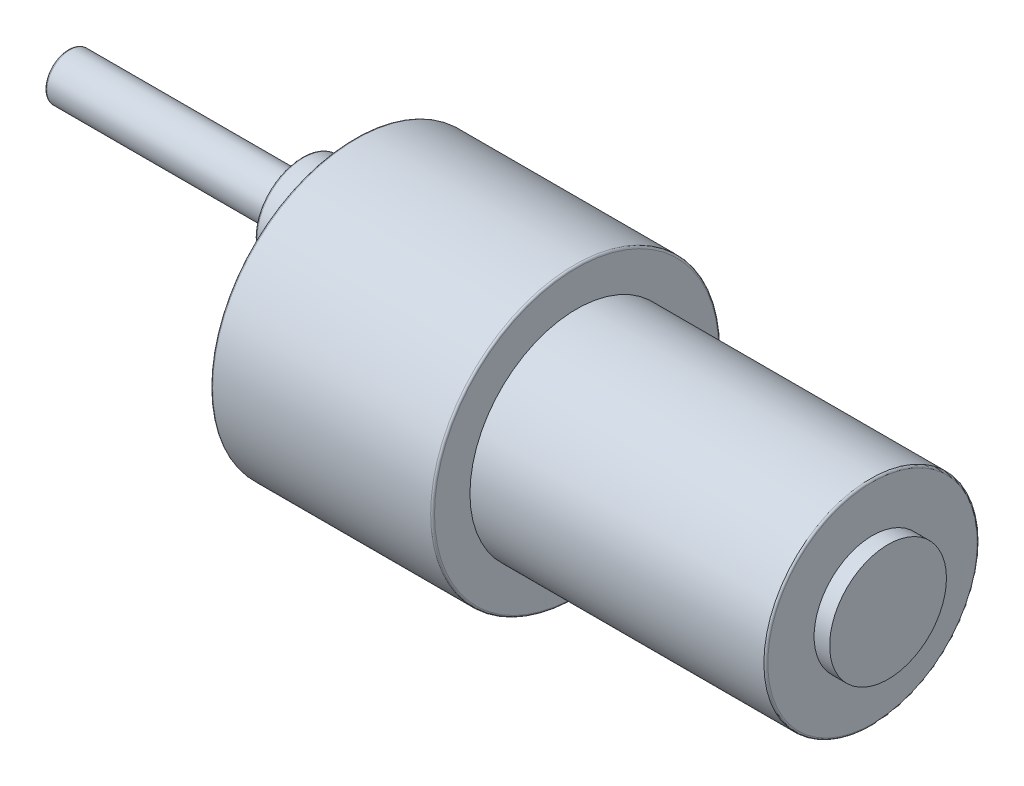
from build123d import *

# Parameters (mm, degrees)
SKETCH1_R                       = 18.5
BOSS_EXTRUDE1_DEPTH             = 28.5
SKETCH2_R                       = 13.7
BOSS_EXTRUDE2_DEPTH             = 38
SKETCH3_R                       = 7.5
BOSS_EXTRUDE3_DEPTH             = 2
TAP_DRILL_FOR_M3X0_5_TAP1_D     = 2.5
TAP_DRILL_FOR_M3X0_5_TAP1_DEPTH = 5
TAP_DRILL_FOR_M3X0_5_TAP1_TIP   = 0.751075774
SKETCH6_R                       = 6
BOSS_EXTRUDE4_DEPTH             = 6.8
SKETCH7_R                       = 3
BOSS_EXTRUDE5_DEPTH             = 30
FILLET1_R                       = 0.25


with BuildPart() as part:
    # Sketch1 → Boss-Extrude1 (new body)
    with BuildSketch(Plane(origin=(0, 0, 0), x_dir=(0, 0, -1), z_dir=(1, 0, 0))):
        with Locations(Location((0, 0, 0), (0, 0, 180))):
            Circle(SKETCH1_R)
    extrude(amount=BOSS_EXTRUDE1_DEPTH)

    # Sketch2 → Boss-Extrude2 (add)
    with BuildSketch(Plane(origin=(28.5, 0, 0), x_dir=(0, 0, -1), z_dir=(1, 0, 0))):
        Circle(SKETCH2_R)
    extrude(amount=BOSS_EXTRUDE2_DEPTH)

    # Sketch3 → Boss-Extrude3 (add)
    with BuildSketch(Plane(origin=(66.5, 0, 0), x_dir=(0, 0, -1), z_dir=(1, 0, 0))):
        Circle(SKETCH3_R)
    extrude(amount=BOSS_EXTRUDE3_DEPTH)

    # Tap Drill for M3x0.5 Tap1
    with Locations(Plane(origin=(0, 15.75, 0), x_dir=(0, 0, -1), z_dir=(-1, 0, 0))):
        with Locations((0, 0), (-13.63990011, 7.875), (-13.63990011, 23.625), (0, 31.5), (13.63990011, 23.625), (13.63990011, 7.875)):
            Hole(TAP_DRILL_FOR_M3X0_5_TAP1_D / 2, depth=TAP_DRILL_FOR_M3X0_5_TAP1_DEPTH)
            with Locations((0, 0, -(TAP_DRILL_FOR_M3X0_5_TAP1_DEPTH + TAP_DRILL_FOR_M3X0_5_TAP1_TIP / 2))):  # 118° drill point
                Cone(0, TAP_DRILL_FOR_M3X0_5_TAP1_D / 2, TAP_DRILL_FOR_M3X0_5_TAP1_TIP, mode=Mode.SUBTRACT)

    # Sketch6 → Boss-Extrude4 (add)
    with BuildSketch(Plane.ZY):
        with Locations(Location((0, 7, 0), (0, 0, 180))):
            Circle(SKETCH6_R)
    extrude(amount=BOSS_EXTRUDE4_DEPTH)

    # Sketch7 → Boss-Extrude5 (add)
    with BuildSketch(Plane.ZY.offset(6.8)):
        with Locations((0, 7)):
            Circle(SKETCH7_R)
    extrude(amount=BOSS_EXTRUDE5_DEPTH)

    # Fillet1
    fillet1_edges = [part.edges().sort_by_distance(p)[0] for p in [
        (0, 0, -18.5),
        (28.5, 0, -18.5),
        (0, 7, 6),
        (-6.8, 7, 6),
        (-6.8, 7, -3),
        (-36.8, 7, -3),
        (66.5, 0, 13.7),
    ]]
    fillet(fillet1_edges, radius=FILLET1_R)


solid = part.part
